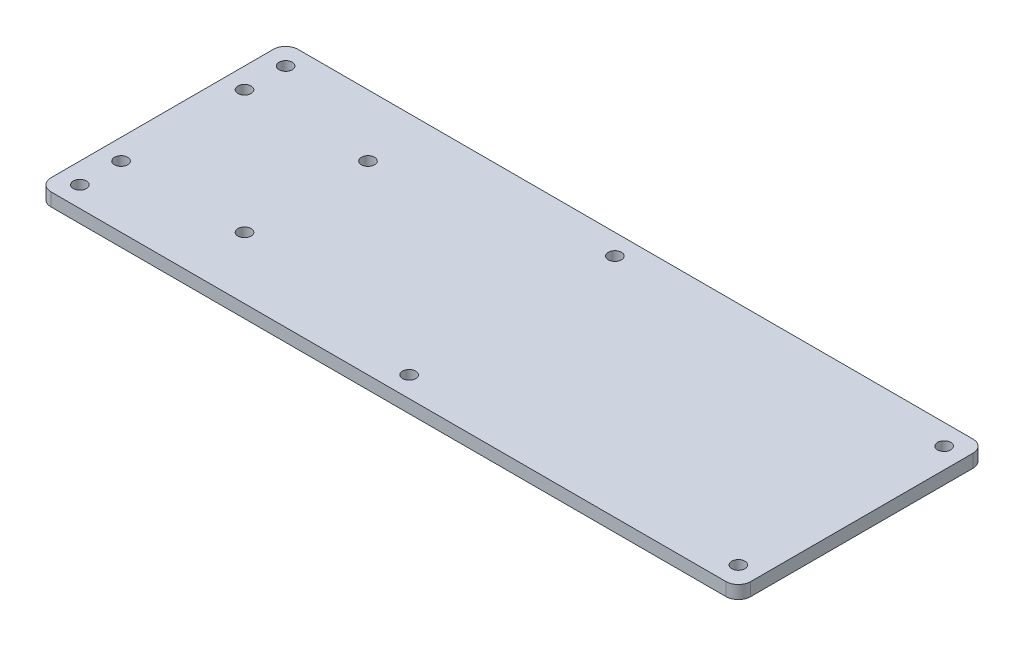
from build123d import *

# Parameters (mm, degrees)
SKETCH1_W           = 170
SKETCH1_H           = 60
BOSS_EXTRUDE1_DEPTH = 3.175
SKETCH2_R           = 1.6
CUT_EXTRUDE1_DEPTH  = 91.1946818
SKETCH3_R           = 1.6
CUT_EXTRUDE2_DEPTH  = 91.1946818
FILLET1_R           = 3


with BuildPart() as part:
    # Sketch1 → Boss-Extrude1 (new body)
    with BuildSketch(Plane(origin=(0, 0, 0), x_dir=(1, 0, 0), z_dir=(0, 1, 0))):
        Rectangle(SKETCH1_W, SKETCH1_H)
    extrude(amount=BOSS_EXTRUDE1_DEPTH)

    # Sketch2 → Cut-Extrude1 (cut, through all)
    with BuildSketch(Plane(origin=(0, 3.175, 0), x_dir=(1, 0, 0), z_dir=(0, 1, 0))):
        with Locations(Location((-80, -25, 0), (0, 0, 270))):
            Circle(SKETCH2_R)
        with Locations(Location((-80, 25, 0), (0, 0, 90))):
            Circle(SKETCH2_R)
        with Locations(Location((80, 25, 0), (0, 0, 270))):
            Circle(SKETCH2_R)
        with Locations(Location((80, -25, 0), (0, 0, 90))):
            Circle(SKETCH2_R)
        with Locations(Location((0, -25, 0), (0, 0, 270))):
            Circle(SKETCH2_R)
        with Locations(Location((0, 25, 0), (0, 0, 90))):
            Circle(SKETCH2_R)
    extrude(amount=-CUT_EXTRUDE1_DEPTH, mode=Mode.SUBTRACT)

    # Sketch3 → Cut-Extrude2 (cut, through all)
    with BuildSketch(Plane(origin=(0, 3.175, 0), x_dir=(1, 0, 0), z_dir=(0, 1, 0))):
        with Locations(Location((-80, -15, 0), (0, 0, 270))):
            Circle(SKETCH3_R)
        with Locations(Location((-80, 15, 0), (0, 0, 90))):
            Circle(SKETCH3_R)
        with Locations(Location((-50, 15, 0), (0, 0, 270))):
            Circle(SKETCH3_R)
        with Locations(Location((-50, -15, 0), (0, 0, 90))):
            Circle(SKETCH3_R)
    extrude(amount=-CUT_EXTRUDE2_DEPTH, mode=Mode.SUBTRACT)

    # Fillet1
    fillet1_edges = [part.edges().sort_by_distance(p)[0] for p in [
        (85, 1.5875, 30),
        (-85, 1.5875, 30),
        (-85, 1.5875, -30),
        (85, 1.5875, -30),
    ]]
    fillet(fillet1_edges, radius=FILLET1_R)


solid = part.part
